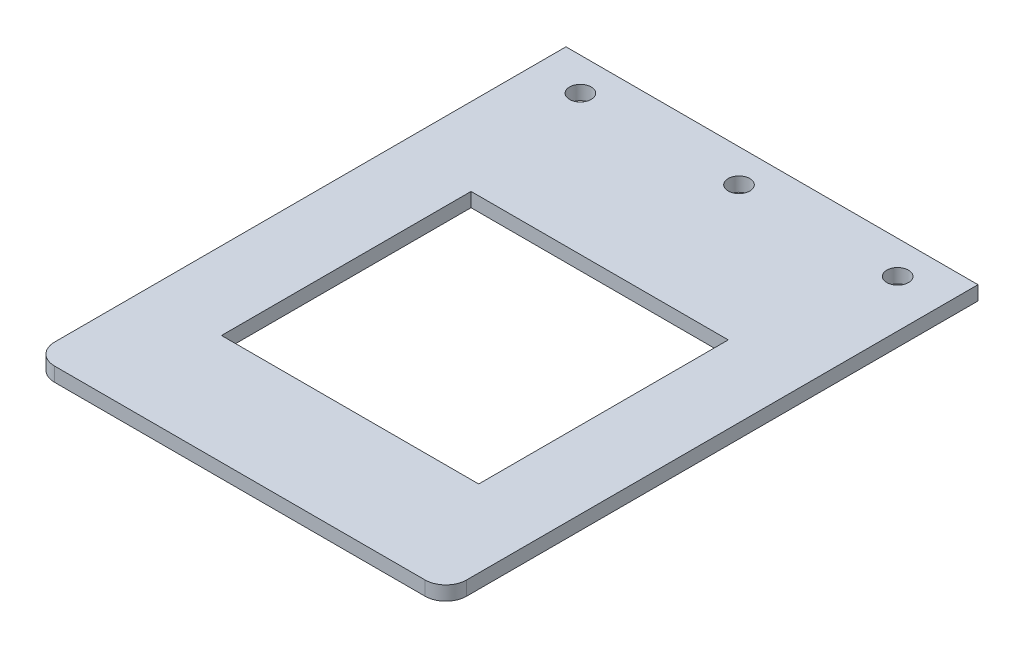
from build123d import *

# Parameters (mm, degrees)
SKETCH1_R           = 1.15
SKETCH1_W           = 27.305
SKETCH1_H           = 26.492
SKETCH1_W_2         = 27.241
SKETCH1_H_2         = 3.747
BOSS_EXTRUDE1_DEPTH = 1.5
SKETCH2_W           = 27.241
SKETCH2_H           = 3.747
BOSS_EXTRUDE2_DEPTH = 2
SKETCH3_W           = 27.241
SKETCH3_H           = 3.747
BOSS_EXTRUDE3_DEPTH = 1.5
SKETCH5_W           = 17.241
SKETCH5_H           = 3.747
BOSS_EXTRUDE4_DEPTH = 3
SKETCH6_W           = 27.241
SKETCH6_H           = 3.747
CUT_EXTRUDE1_DEPTH  = 2


with BuildPart() as part:
    # Sketch1 → Boss-Extrude1 (new body)
    with BuildSketch(Plane(origin=(0, 0, 0), x_dir=(1, 0, 0), z_dir=(0, 1, 0))):
        with BuildLine():
            Line((-25.193654123, -23.311779602), (-25.193654123, 28.483220398))
            Line((-25.193654123, 28.483220398), (18.545345877, 28.483220398))
            Line((18.545345877, 28.483220398), (18.545345877, -23.311779602))
            Line((18.545345877, -23.311779602), (18.545345877, -24.511779602))
            Line((18.545345877, -24.511779602), (18.545345877, -25.811779602))
            ThreePointArc((18.545345877, -25.811779602), (17.900980796, -27.367414521), (16.345345877, -28.011779602))
            Line((16.345345877, -28.011779602), (-22.993654123, -28.011779602))
            ThreePointArc((-22.993654123, -28.011779602), (-24.549289041, -27.367414521), (-25.193654123, -25.811779602))
            Line((-25.193654123, -25.811779602), (-25.193654123, -24.511779602))
            Line((-25.193654123, -24.511779602), (-25.193654123, -23.311779602))
        make_face()
        with Locations(Location((-20.164926555, 24.983220398, 0), (0, 0, 270))):
            Circle(SKETCH1_R, mode=Mode.SUBTRACT)
        with Locations(Location((-3.324926555, 24.983220398, 0), (0, 0, 270))):
            Circle(SKETCH1_R, mode=Mode.SUBTRACT)
        with Locations(Location((13.515073445, 24.983220398, 0), (0, 0, 270))):
            Circle(SKETCH1_R, mode=Mode.SUBTRACT)
        with Locations((-3.285420702, -3.096858745)):
            Rectangle(SKETCH1_W, SKETCH1_H, mode=Mode.SUBTRACT)
        with Locations((-0.666632566, 16.558921478)):
            Rectangle(SKETCH1_W_2, SKETCH1_H_2, mode=Mode.SUBTRACT)
    extrude(amount=BOSS_EXTRUDE1_DEPTH)



with BuildPart() as body_2:
    # Sketch2 → Boss-Extrude2 (new body)
    with BuildSketch(Plane(origin=(0, 1.5, 0), x_dir=(1, 0, 0), z_dir=(0, 1, 0))):
        with Locations((-0.666632566, 16.558921478)):
            Rectangle(SKETCH2_W, SKETCH2_H)
    extrude(amount=BOSS_EXTRUDE2_DEPTH)


with BuildPart() as part_1:
    add(part.part)

    add(body_2.part)  # Boss-Extrude3 merges body 2
    # Sketch3 → Boss-Extrude3 (add)
    with BuildSketch(Plane.XZ.offset(-1.5)):
        with Locations((-0.666632566, -16.558921478)):
            Rectangle(SKETCH3_W, SKETCH3_H)
    extrude(amount=BOSS_EXTRUDE3_DEPTH)

    # Sketch5 → Boss-Extrude4 (add)
    with BuildSketch(Plane.XZ):
        with Locations((-0.666632566, -16.558921478)):
            Rectangle(SKETCH5_W, SKETCH5_H)
    extrude(amount=BOSS_EXTRUDE4_DEPTH)

    # Sketch6 → Cut-Extrude1 (cut)
    with BuildSketch(Plane(origin=(0, 3.5, 0), x_dir=(1, 0, 0), z_dir=(0, 1, 0))):
        with Locations((-0.666632566, 16.558921478)):
            Rectangle(SKETCH6_W, SKETCH6_H)
    extrude(amount=-CUT_EXTRUDE1_DEPTH, mode=Mode.SUBTRACT)


solid = part_1.part
